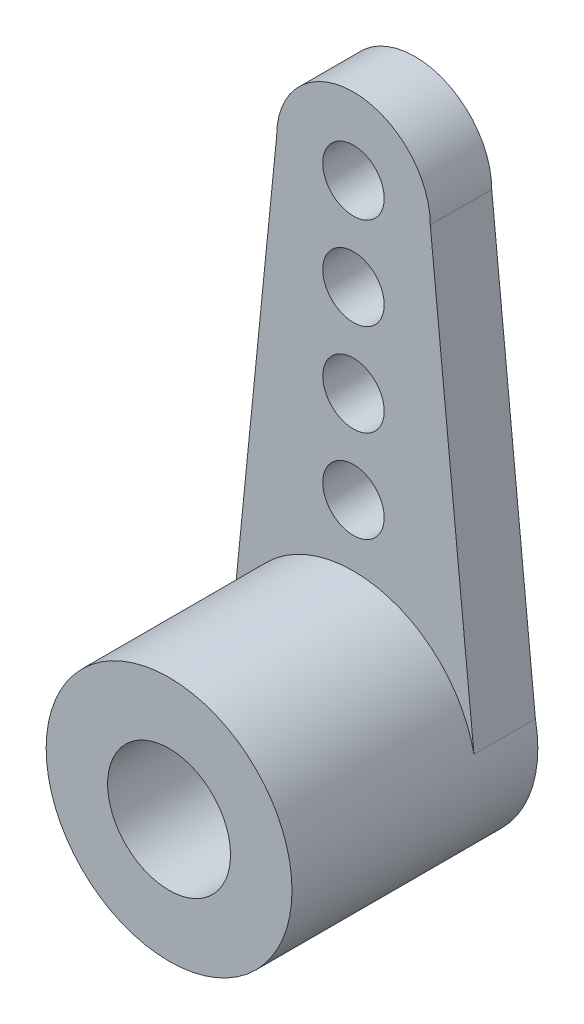
from build123d import *

# Parameters (mm, degrees)
SCHIZZO1_R                           = 4
ESTRUSIONE_ESTRUSIONE1_DEPTH         = 8
SVUOTA1_T                            = -2
ESTRUSIONE_ESTRUSIONE3_DEPTH         = 2
TAGLIO_ESTRUSIONE2_REACH             = 21.653
SCHIZZO4_R                           = 1
TAGLIO_ESTRUSIONE1_REACH             = 21.653
SCHIZZO2_R                           = 1.5
TAGLIO_ESTRUSIONE1_DIRECTION_2_DEPTH = 10


with BuildPart() as part:
    # Schizzo1 → Estrusione-Estrusione1 (new body)
    with BuildSketch(Plane.XY):
        Circle(SCHIZZO1_R)
    extrude(amount=ESTRUSIONE_ESTRUSIONE1_DEPTH)

    # Svuota1
    svuota1_openings = [part.faces().sort_by_distance(p)[0] for p in [
        (0, 0, 8),
    ]]
    offset(amount=SVUOTA1_T, openings=svuota1_openings, kind=Kind.INTERSECTION)

    # Schizzo5 → Estrusione-Estrusione3 (add)
    with BuildSketch(Plane(origin=(0, 0, 0), x_dir=(-1, 0, 0), z_dir=(0, 0, -1))):
        with BuildLine():
            ThreePointArc((-3.920792079, 0.792079208), (0, 4), (3.920792079, 0.792079208))
            Line((3.920792079, 0.792079208), (2.5, 15))
            ThreePointArc((2.5, 15), (0, 17.5), (-2.5, 15))
            Line((-2.5, 15), (-3.920792079, 0.792079208))
        make_face()
    extrude(amount=-ESTRUSIONE_ESTRUSIONE3_DEPTH)

    # Schizzo4 → Taglio-Estrusione2 (cut, up to next)
    with BuildSketch(Plane(origin=(0, 0, 0), x_dir=(-1, 0, 0), z_dir=(0, 0, -1)), mode=Mode.PRIVATE) as taglio_estrusione2_sk1:
        with Locations((0, 6)):
            Circle(SCHIZZO4_R)
    taglio_estrusione2_tool1 = extrude(taglio_estrusione2_sk1.sketch, amount=-TAGLIO_ESTRUSIONE2_REACH, mode=Mode.PRIVATE) & part.part
    # Schizzo4 → Taglio-Estrusione2 (cut, up to next)
    with BuildSketch(Plane(origin=(0, 0, 0), x_dir=(-1, 0, 0), z_dir=(0, 0, -1)), mode=Mode.PRIVATE) as taglio_estrusione2_sk2:
        with Locations((0, 9)):
            Circle(SCHIZZO4_R)
    taglio_estrusione2_tool2 = extrude(taglio_estrusione2_sk2.sketch, amount=-TAGLIO_ESTRUSIONE2_REACH, mode=Mode.PRIVATE) & part.part
    # Schizzo4 → Taglio-Estrusione2 (cut, up to next)
    with BuildSketch(Plane(origin=(0, 0, 0), x_dir=(-1, 0, 0), z_dir=(0, 0, -1)), mode=Mode.PRIVATE) as taglio_estrusione2_sk3:
        with Locations((0, 12)):
            Circle(SCHIZZO4_R)
    taglio_estrusione2_tool3 = extrude(taglio_estrusione2_sk3.sketch, amount=-TAGLIO_ESTRUSIONE2_REACH, mode=Mode.PRIVATE) & part.part
    # Schizzo4 → Taglio-Estrusione2 (cut, up to next)
    with BuildSketch(Plane(origin=(0, 0, 0), x_dir=(-1, 0, 0), z_dir=(0, 0, -1)), mode=Mode.PRIVATE) as taglio_estrusione2_sk4:
        with Locations((0, 15)):
            Circle(SCHIZZO4_R)
    taglio_estrusione2_tool4 = extrude(taglio_estrusione2_sk4.sketch, amount=-TAGLIO_ESTRUSIONE2_REACH, mode=Mode.PRIVATE) & part.part
    add(taglio_estrusione2_tool1.solids().sort_by_distance((0, 6, 0))[0], mode=Mode.SUBTRACT)
    add(taglio_estrusione2_tool2.solids().sort_by_distance((0, 9, 0))[0], mode=Mode.SUBTRACT)
    add(taglio_estrusione2_tool3.solids().sort_by_distance((0, 12, 0))[0], mode=Mode.SUBTRACT)
    add(taglio_estrusione2_tool4.solids().sort_by_distance((0, 15, 0))[0], mode=Mode.SUBTRACT)

    # Schizzo2 → Taglio-Estrusione1 (cut, up to next)
    with BuildSketch(Plane(origin=(0, 0, 0), x_dir=(-1, 0, 0), z_dir=(0, 0, -1)), mode=Mode.PRIVATE) as taglio_estrusione1_sk1:
        Circle(SCHIZZO2_R)
    taglio_estrusione1_tool1 = extrude(taglio_estrusione1_sk1.sketch, amount=-TAGLIO_ESTRUSIONE1_REACH, mode=Mode.PRIVATE) & part.part
    add(taglio_estrusione1_tool1.solids().sort_by_distance((0, 0, 0))[0], mode=Mode.SUBTRACT)

    # Schizzo2 → Taglio-Estrusione1 direction 2 (cut)
    with BuildSketch(Plane(origin=(0, 0, 0), x_dir=(-1, 0, 0), z_dir=(0, 0, -1))):
        Circle(SCHIZZO2_R)
    extrude(amount=TAGLIO_ESTRUSIONE1_DIRECTION_2_DEPTH, mode=Mode.SUBTRACT)


solid = part.part
